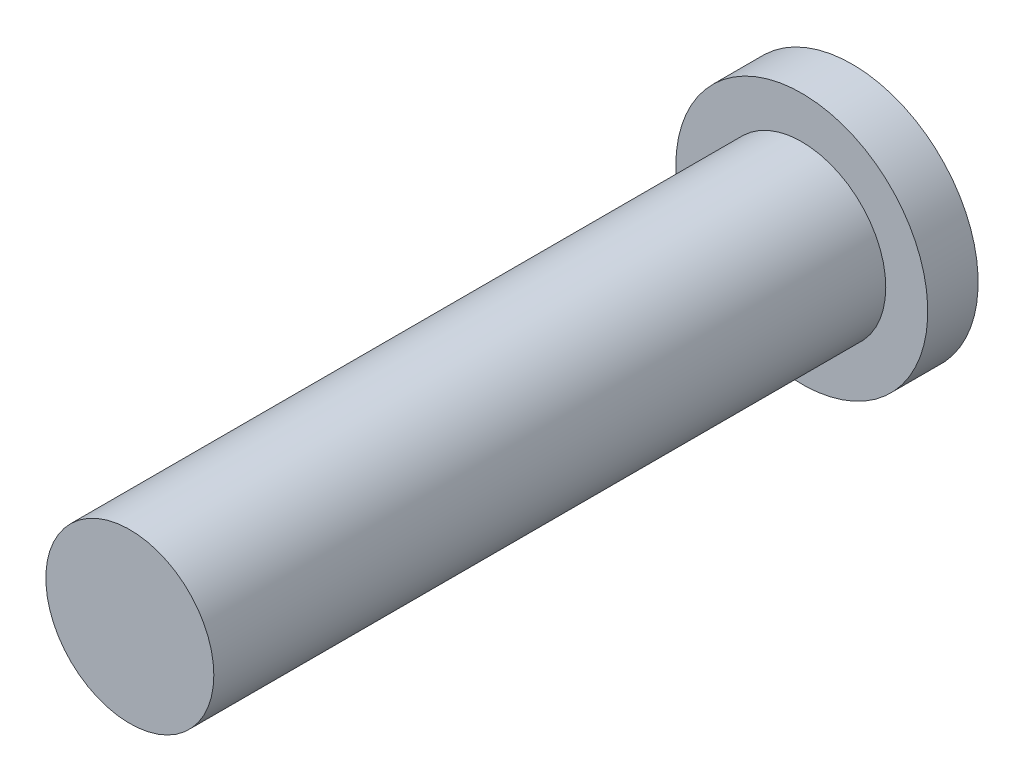
from build123d import *

# Parameters (mm, degrees)
CROQUIS1_R              = 5
SALIENTE_EXTRUIR1_DEPTH = 40
CROQUIS2_R              = 7.5
SALIENTE_EXTRUIR2_DEPTH = 3


with BuildPart() as part:
    # Croquis1 → Saliente-Extruir1 (new body)
    with BuildSketch(Plane.XY):
        Circle(CROQUIS1_R)
    extrude(amount=SALIENTE_EXTRUIR1_DEPTH)

    # Croquis2 → Saliente-Extruir2 (add)
    with BuildSketch(Plane(origin=(0, 0, 0), x_dir=(-1, 0, 0), z_dir=(0, 0, -1))):
        Circle(CROQUIS2_R)
    extrude(amount=SALIENTE_EXTRUIR2_DEPTH)


solid = part.part
